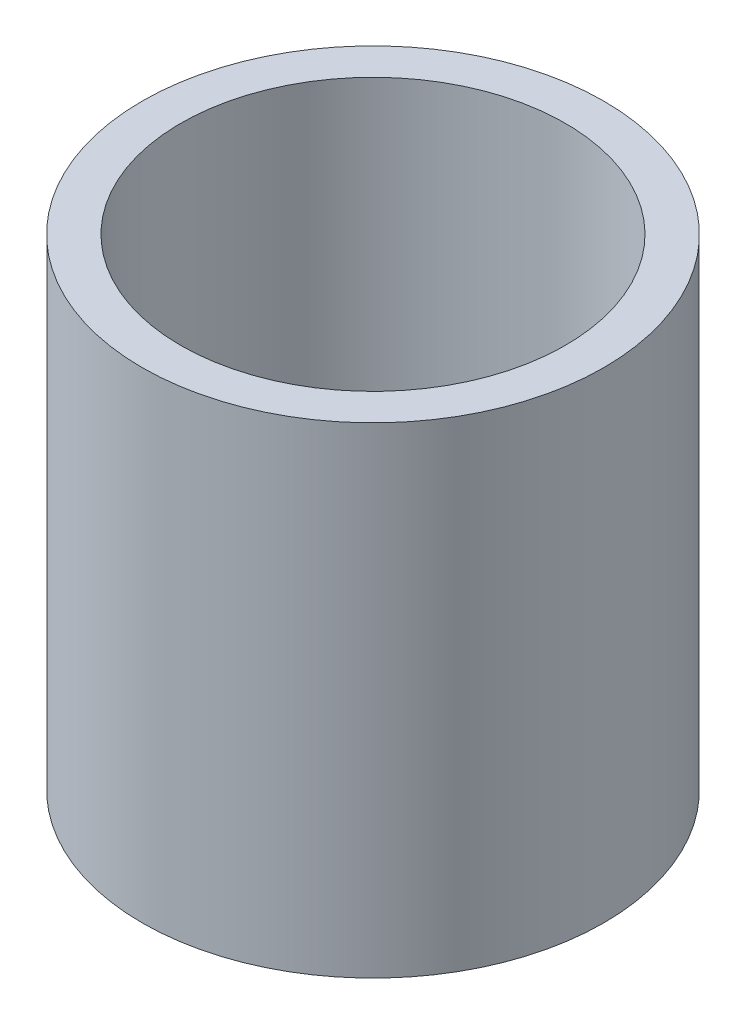
from build123d import *

# Parameters (mm, degrees)
SKETCH1_R           = 12
SKETCH1_R_2         = 10
BOSS_EXTRUDE1_DEPTH = 25


with BuildPart() as part:
    # Sketch1 → Boss-Extrude1 (new body)
    with BuildSketch(Plane(origin=(0, 0, 0), x_dir=(1, 0, 0), z_dir=(0, 1, 0))):
        with Locations(Location((0, 0, 0), (0, 0, 270))):
            Circle(SKETCH1_R)
        with Locations(Location((0, 0, 0), (0, 0, 270))):
            Circle(SKETCH1_R_2, mode=Mode.SUBTRACT)
    extrude(amount=BOSS_EXTRUDE1_DEPTH)


solid = part.part
